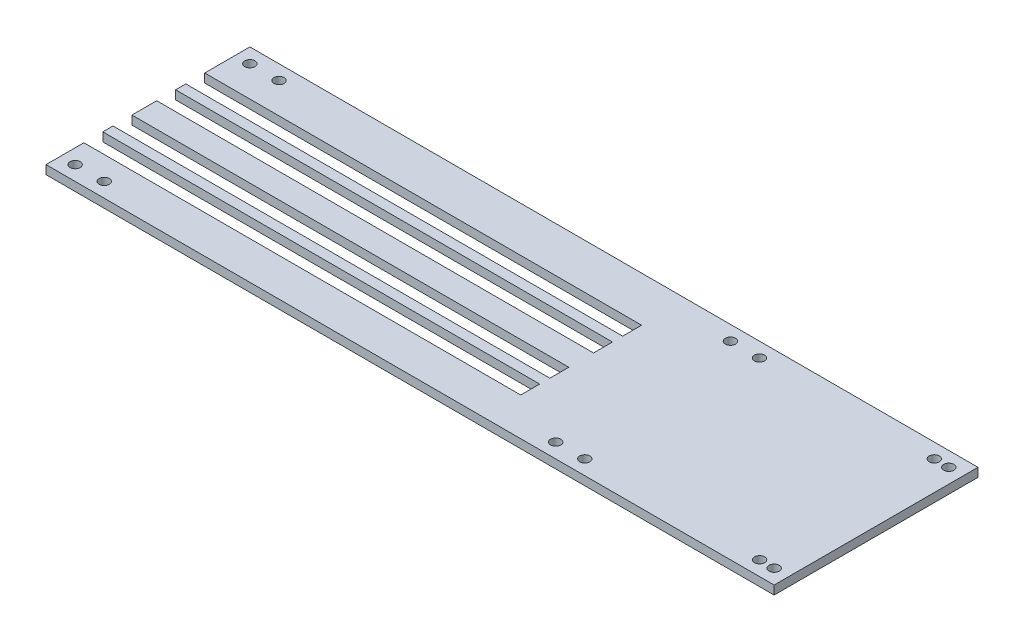
from build123d import *

# Parameters (mm, degrees)
BOSS_EXTRUDE1_DEPTH = 3
SKETCH2_R           = 1.75
CUT_EXTRUDE1_DEPTH  = 10
SKETCH3_R           = 1.75
CUT_EXTRUDE2_DEPTH  = 10


with BuildPart() as part:
    # Sketch1 → Boss-Extrude1 (new body)
    with BuildSketch(Plane(origin=(0, 0, 0), x_dir=(1, 0, 0), z_dir=(0, 1, 0))):
        Polygon((-150, 29.5), (0, 29.5), (0, 23), (-150, 23), (-150, 19.5), (0, 19.5), (0, 13), (-150, 13), (-150, 0), (0, 0), (100, 0), (100, 70), (-50, 70), (-150, 70), (-150, 54.5), (0, 54.5), (0, 48), (-150, 48), (-150, 44.5), (0, 44.5), (0, 38), (-150, 38), align=None)
    extrude(amount=BOSS_EXTRUDE1_DEPTH)

    # Sketch2 → Cut-Extrude1 (cut)
    with BuildSketch(Plane(origin=(0, 3, 0), x_dir=(1, 0, 0), z_dir=(0, 1, 0))):
        with Locations(Location((-145, 65, 0), (0, 0, 270))):
            Circle(SKETCH2_R)
        with Locations(Location((-135, 65, 0), (0, 0, 270))):
            Circle(SKETCH2_R)
        with Locations(Location((20, 65, 0), (0, 0, 270))):
            Circle(SKETCH2_R)
        with Locations(Location((30, 65, 0), (0, 0, 270))):
            Circle(SKETCH2_R)
    cut_extrude1 = extrude(amount=-CUT_EXTRUDE1_DEPTH, mode=Mode.SUBTRACT)

    # Sketch3 → Cut-Extrude2 (cut)
    with BuildSketch(Plane(origin=(0, 3, 0), x_dir=(1, 0, 0), z_dir=(0, 1, 0))):
        with Locations(Location((95, 65, 0), (0, 0, 270))):
            Circle(SKETCH3_R)
        with Locations(Location((90, 65, 0), (0, 0, 270))):
            Circle(SKETCH3_R)
    cut_extrude2 = extrude(amount=-CUT_EXTRUDE2_DEPTH, mode=Mode.SUBTRACT)

    # Mirror1: Cut-Extrude1, Cut-Extrude2 across plane
    add(cut_extrude1.mirror(Plane(origin=(0, 0, -35), x_dir=(1, 0, 0), z_dir=(0, 0, -1))), mode=Mode.SUBTRACT)
    add(cut_extrude2.mirror(Plane(origin=(0, 0, -35), x_dir=(1, 0, 0), z_dir=(0, 0, -1))), mode=Mode.SUBTRACT)


solid = part.part
